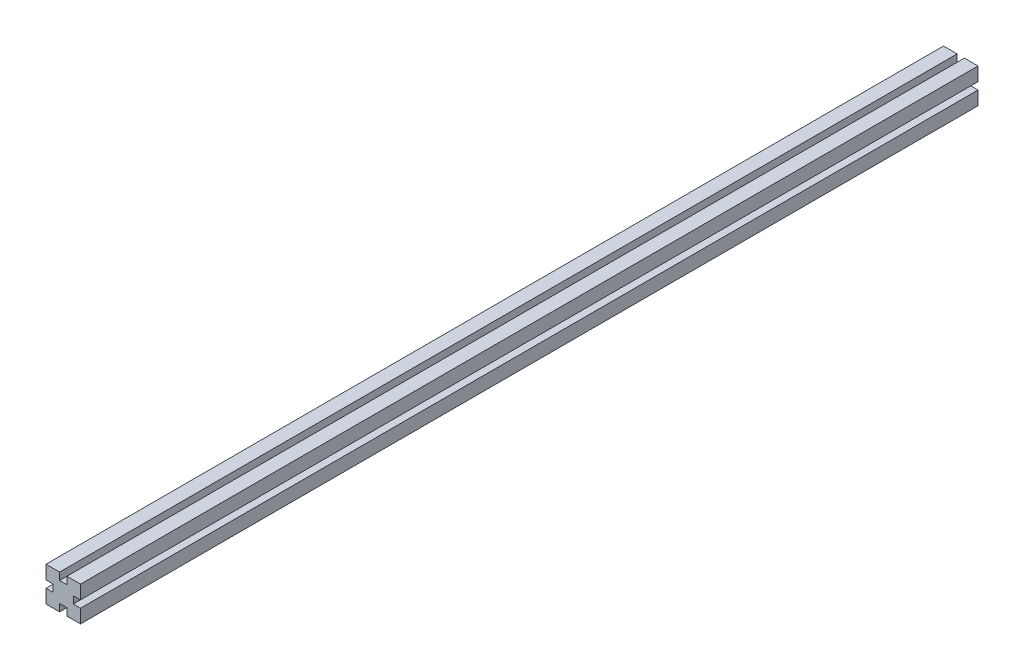
from build123d import *

# Parameters (mm, degrees)
PROFILE_DEPTH = 991.11


with BuildPart() as part:
    # Sketch1 → Profile (new body)
    with BuildSketch(Plane.XY):
        Polygon((-19.05, -19.05), (-4, -19.05), (-4, -11.05), (4, -11.05), (4, -19.05), (19.05, -19.05), (19.05, -4), (11.05, -4), (11.05, 4), (19.05, 4), (19.05, 19.05), (4, 19.05), (4, 11.05), (-4, 11.05), (-4, 19.05), (-19.05, 19.05), (-19.05, 4), (-11.05, 4), (-11.05, -4), (-19.05, -4), align=None)
    extrude(amount=PROFILE_DEPTH)


solid = part.part
